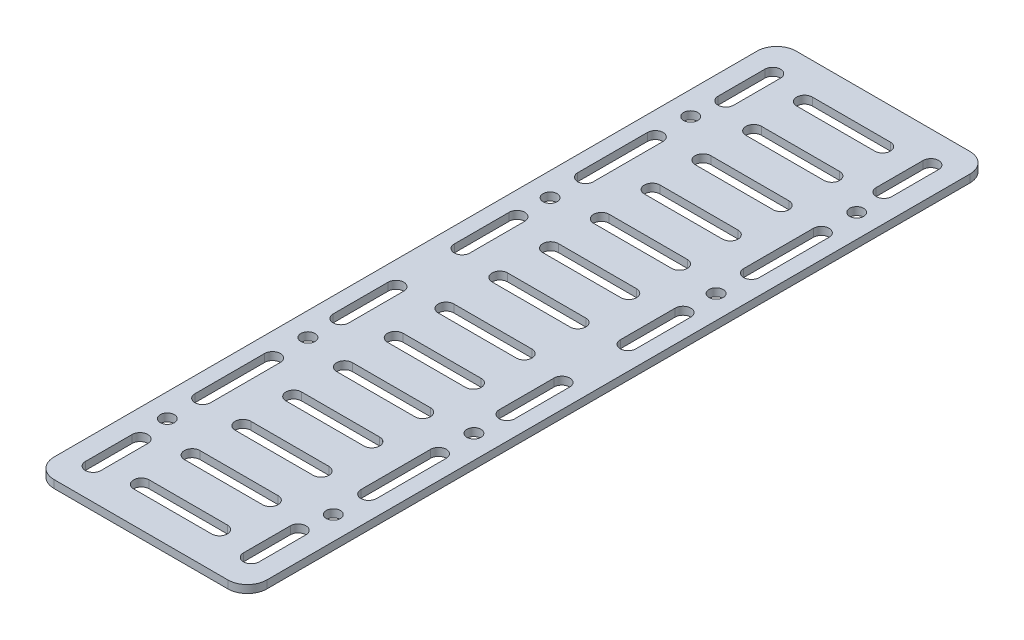
from build123d import *

# Parameters (mm, degrees)
SKETCH1_W            = 54.5
SKETCH1_H            = 190
BOSS_EXTRUDE1_DEPTH  = 2
M3_CLEARANCE_HOLE1_D = 3.6
CUT_EXTRUDE1_DEPTH   = 99.851213953
FILLET1_R            = 5


with BuildPart() as part:
    # Sketch1 → Boss-Extrude1 (new body)
    with BuildSketch(Plane(origin=(0, 0, 0), x_dir=(1, 0, 0), z_dir=(0, 1, 0))):
        Rectangle(SKETCH1_W, SKETCH1_H)
    extrude(amount=BOSS_EXTRUDE1_DEPTH)

    # M3 Clearance Hole1 (through all)
    with Locations(Plane(origin=(0, 2, 0), x_dir=(1, 0, 0), z_dir=(0, 1, 0))):
        with Locations((-21.25, 67), (-21.25, 31), (21.25, 67), (21.25, 31), (21.25, -31), (21.25, -67), (-21.25, -67), (-21.25, -31)):
            Hole(M3_CLEARANCE_HOLE1_D / 2)

    # Sketch5 → Cut-Extrude1 (cut, through all)
    with BuildSketch(Plane(origin=(0, 2, 0), x_dir=(1, 0, 0), z_dir=(0, 1, 0))):
        with BuildLine():
            Line((-18.25, 87), (-18.25, 75))
            ThreePointArc((-18.25, 75), (-20.25, 73), (-22.25, 75))
            Line((-22.25, 75), (-22.25, 87))
            ThreePointArc((-22.25, 87), (-20.25, 89), (-18.25, 87))
        make_face()
        with BuildLine():
            Line((18.25, 87), (18.25, 75))
            ThreePointArc((18.25, 75), (20.25, 73), (22.25, 75))
            Line((22.25, 75), (22.25, 87))
            ThreePointArc((22.25, 87), (20.25, 89), (18.25, 87))
        make_face()
        with BuildLine():
            Line((-10, 86.885191349), (10, 86.885191349))
            ThreePointArc((10, 86.885191349), (12, 84.885191349), (10, 82.885191349))
            Line((10, 82.885191349), (-10, 82.885191349))
            ThreePointArc((-10, 82.885191349), (-12, 84.885191349), (-10, 86.885191349))
        make_face()
        with BuildLine():
            Line((-10, 73.885191349), (10, 73.885191349))
            ThreePointArc((10, 73.885191349), (12, 71.885191349), (10, 69.885191349))
            Line((10, 69.885191349), (-10, 69.885191349))
            ThreePointArc((-10, 69.885191349), (-12, 71.885191349), (-10, 73.885191349))
        make_face()
        with BuildLine():
            Line((-10, 60.885191349), (10, 60.885191349))
            ThreePointArc((10, 60.885191349), (12, 58.885191349), (10, 56.885191349))
            Line((10, 56.885191349), (-10, 56.885191349))
            ThreePointArc((-10, 56.885191349), (-12, 58.885191349), (-10, 60.885191349))
        make_face()
        with BuildLine():
            Line((-10, 47.885191349), (10, 47.885191349))
            ThreePointArc((10, 47.885191349), (12, 45.885191349), (10, 43.885191349))
            Line((10, 43.885191349), (-10, 43.885191349))
            ThreePointArc((-10, 43.885191349), (-12, 45.885191349), (-10, 47.885191349))
        make_face()
        with BuildLine():
            Line((-10, 34.885191349), (10, 34.885191349))
            ThreePointArc((10, 34.885191349), (12, 32.885191349), (10, 30.885191349))
            Line((10, 30.885191349), (-10, 30.885191349))
            ThreePointArc((-10, 30.885191349), (-12, 32.885191349), (-10, 34.885191349))
        make_face()
        with BuildLine():
            Line((-10, 21.885191349), (10, 21.885191349))
            ThreePointArc((10, 21.885191349), (12, 19.885191349), (10, 17.885191349))
            Line((10, 17.885191349), (-10, 17.885191349))
            ThreePointArc((-10, 17.885191349), (-12, 19.885191349), (-10, 21.885191349))
        make_face()
        with BuildLine():
            Line((-10, 8.885191349), (10, 8.885191349))
            ThreePointArc((10, 8.885191349), (12, 6.885191349), (10, 4.885191349))
            Line((10, 4.885191349), (-10, 4.885191349))
            ThreePointArc((-10, 4.885191349), (-12, 6.885191349), (-10, 8.885191349))
        make_face()
        with BuildLine():
            Line((-19.25, 57.932734115), (-19.25, 40.067265885))
            ThreePointArc((-19.25, 40.067265885), (-21.25, 38.067265885), (-23.25, 40.067265885))
            Line((-23.25, 40.067265885), (-23.25, 57.932734115))
            ThreePointArc((-23.25, 57.932734115), (-21.25, 59.932734115), (-19.25, 57.932734115))
        make_face()
        with BuildLine():
            Line((-19.25, 22.533690779), (-19.25, 8.466309221))
            ThreePointArc((-19.25, 8.466309221), (-21.25, 6.466309221), (-23.25, 8.466309221))
            Line((-23.25, 8.466309221), (-23.25, 22.533690779))
            ThreePointArc((-23.25, 22.533690779), (-21.25, 24.533690779), (-19.25, 22.533690779))
        make_face()
        with BuildLine():
            Line((19.25, 57.932734115), (19.25, 40.067265885))
            ThreePointArc((19.25, 40.067265885), (21.25, 38.067265885), (23.25, 40.067265885))
            Line((23.25, 40.067265885), (23.25, 57.932734115))
            ThreePointArc((23.25, 57.932734115), (21.25, 59.932734115), (19.25, 57.932734115))
        make_face()
        with BuildLine():
            Line((19.25, 22.533690779), (19.25, 8.466309221))
            ThreePointArc((19.25, 8.466309221), (21.25, 6.466309221), (23.25, 8.466309221))
            Line((23.25, 8.466309221), (23.25, 22.533690779))
            ThreePointArc((23.25, 22.533690779), (21.25, 24.533690779), (19.25, 22.533690779))
        make_face()
        with BuildLine():
            Line((-18.25, -87), (-18.25, -75))
            ThreePointArc((-18.25, -75), (-20.25, -73), (-22.25, -75))
            Line((-22.25, -75), (-22.25, -87))
            ThreePointArc((-22.25, -87), (-20.25, -89), (-18.25, -87))
        make_face()
        with BuildLine():
            Line((18.25, -87), (18.25, -75))
            ThreePointArc((18.25, -75), (20.25, -73), (22.25, -75))
            Line((22.25, -75), (22.25, -87))
            ThreePointArc((22.25, -87), (20.25, -89), (18.25, -87))
        make_face()
        with BuildLine():
            Line((-10, -86.885191349), (10, -86.885191349))
            ThreePointArc((10, -86.885191349), (12, -84.885191349), (10, -82.885191349))
            Line((10, -82.885191349), (-10, -82.885191349))
            ThreePointArc((-10, -82.885191349), (-12, -84.885191349), (-10, -86.885191349))
        make_face()
        with BuildLine():
            Line((-10, -73.885191349), (10, -73.885191349))
            ThreePointArc((10, -73.885191349), (12, -71.885191349), (10, -69.885191349))
            Line((10, -69.885191349), (-10, -69.885191349))
            ThreePointArc((-10, -69.885191349), (-12, -71.885191349), (-10, -73.885191349))
        make_face()
        with BuildLine():
            Line((-10, -60.885191349), (10, -60.885191349))
            ThreePointArc((10, -60.885191349), (12, -58.885191349), (10, -56.885191349))
            Line((10, -56.885191349), (-10, -56.885191349))
            ThreePointArc((-10, -56.885191349), (-12, -58.885191349), (-10, -60.885191349))
        make_face()
        with BuildLine():
            Line((-10, -47.885191349), (10, -47.885191349))
            ThreePointArc((10, -47.885191349), (12, -45.885191349), (10, -43.885191349))
            Line((10, -43.885191349), (-10, -43.885191349))
            ThreePointArc((-10, -43.885191349), (-12, -45.885191349), (-10, -47.885191349))
        make_face()
        with BuildLine():
            Line((-10, -34.885191349), (10, -34.885191349))
            ThreePointArc((10, -34.885191349), (12, -32.885191349), (10, -30.885191349))
            Line((10, -30.885191349), (-10, -30.885191349))
            ThreePointArc((-10, -30.885191349), (-12, -32.885191349), (-10, -34.885191349))
        make_face()
        with BuildLine():
            Line((-10, -21.885191349), (10, -21.885191349))
            ThreePointArc((10, -21.885191349), (12, -19.885191349), (10, -17.885191349))
            Line((10, -17.885191349), (-10, -17.885191349))
            ThreePointArc((-10, -17.885191349), (-12, -19.885191349), (-10, -21.885191349))
        make_face()
        with BuildLine():
            Line((-10, -8.885191349), (10, -8.885191349))
            ThreePointArc((10, -8.885191349), (12, -6.885191349), (10, -4.885191349))
            Line((10, -4.885191349), (-10, -4.885191349))
            ThreePointArc((-10, -4.885191349), (-12, -6.885191349), (-10, -8.885191349))
        make_face()
        with BuildLine():
            Line((-19.25, -57.932734115), (-19.25, -40.067265885))
            ThreePointArc((-19.25, -40.067265885), (-21.25, -38.067265885), (-23.25, -40.067265885))
            Line((-23.25, -40.067265885), (-23.25, -57.932734115))
            ThreePointArc((-23.25, -57.932734115), (-21.25, -59.932734115), (-19.25, -57.932734115))
        make_face()
        with BuildLine():
            Line((-19.25, -22.533690779), (-19.25, -8.466309221))
            ThreePointArc((-19.25, -8.466309221), (-21.25, -6.466309221), (-23.25, -8.466309221))
            Line((-23.25, -8.466309221), (-23.25, -22.533690779))
            ThreePointArc((-23.25, -22.533690779), (-21.25, -24.533690779), (-19.25, -22.533690779))
        make_face()
        with BuildLine():
            Line((19.25, -57.932734115), (19.25, -40.067265885))
            ThreePointArc((19.25, -40.067265885), (21.25, -38.067265885), (23.25, -40.067265885))
            Line((23.25, -40.067265885), (23.25, -57.932734115))
            ThreePointArc((23.25, -57.932734115), (21.25, -59.932734115), (19.25, -57.932734115))
        make_face()
        with BuildLine():
            Line((19.25, -22.533690779), (19.25, -8.466309221))
            ThreePointArc((19.25, -8.466309221), (21.25, -6.466309221), (23.25, -8.466309221))
            Line((23.25, -8.466309221), (23.25, -22.533690779))
            ThreePointArc((23.25, -22.533690779), (21.25, -24.533690779), (19.25, -22.533690779))
        make_face()
    extrude(amount=-CUT_EXTRUDE1_DEPTH, mode=Mode.SUBTRACT)

    # Fillet1
    fillet1_edges = [part.edges().sort_by_distance(p)[0] for p in [
        (27.25, 1, 95),
        (-27.25, 1, 95),
        (-27.25, 1, -95),
        (27.25, 1, -95),
    ]]
    fillet(fillet1_edges, radius=FILLET1_R)


solid = part.part
